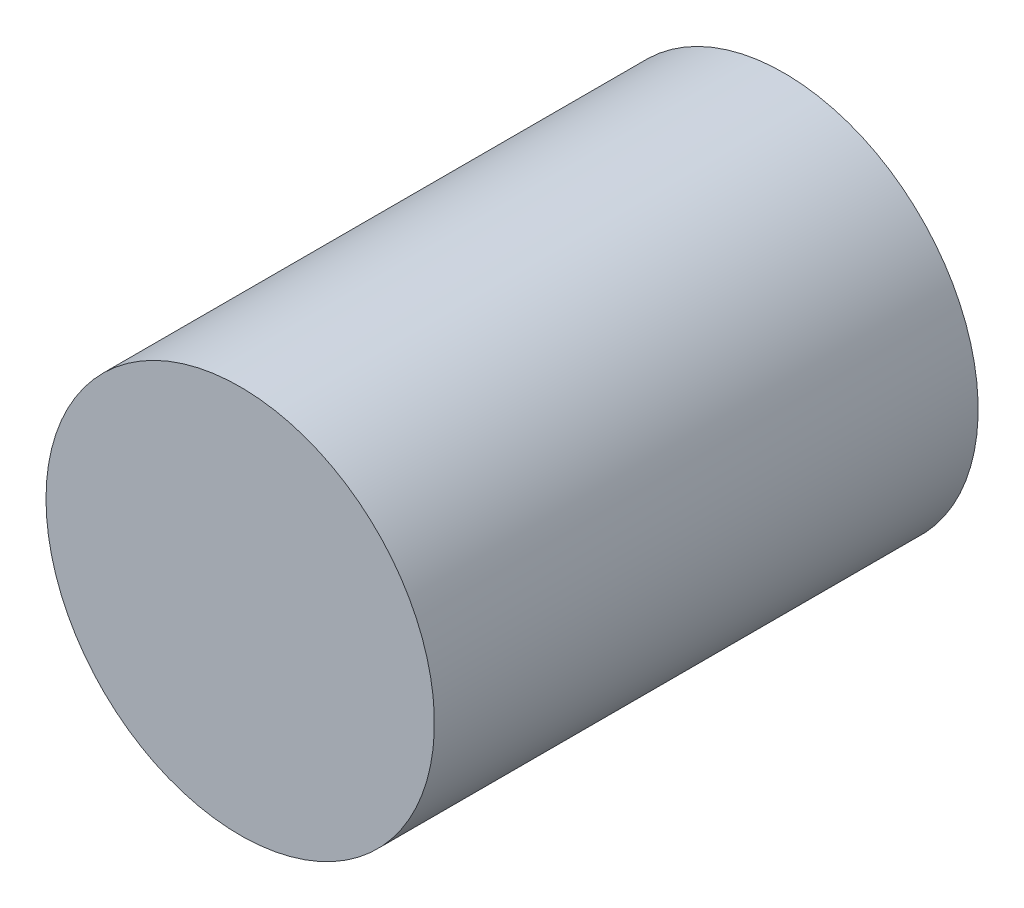
from build123d import *

# Parameters (mm, degrees)
BOSS_EXTRUDE1_DEPTH      = 7
BOSS_EXTRUDE1_DEPTH_BACK = 7
SKETCH1_R                = 5


with BuildPart() as part:
    # Sketch1 → Boss-Extrude1 (new, two sides: drawn at the far end of the back side and taken through both)
    with BuildSketch(Plane(origin=(0, 0, 2.5), x_dir=(-1, 0, 0), z_dir=(0, 0, -1)).offset(-BOSS_EXTRUDE1_DEPTH_BACK)):
        with Locations((0, 92.5)):
            Circle(SKETCH1_R)
    extrude(amount=BOSS_EXTRUDE1_DEPTH + BOSS_EXTRUDE1_DEPTH_BACK)


solid = part.part
